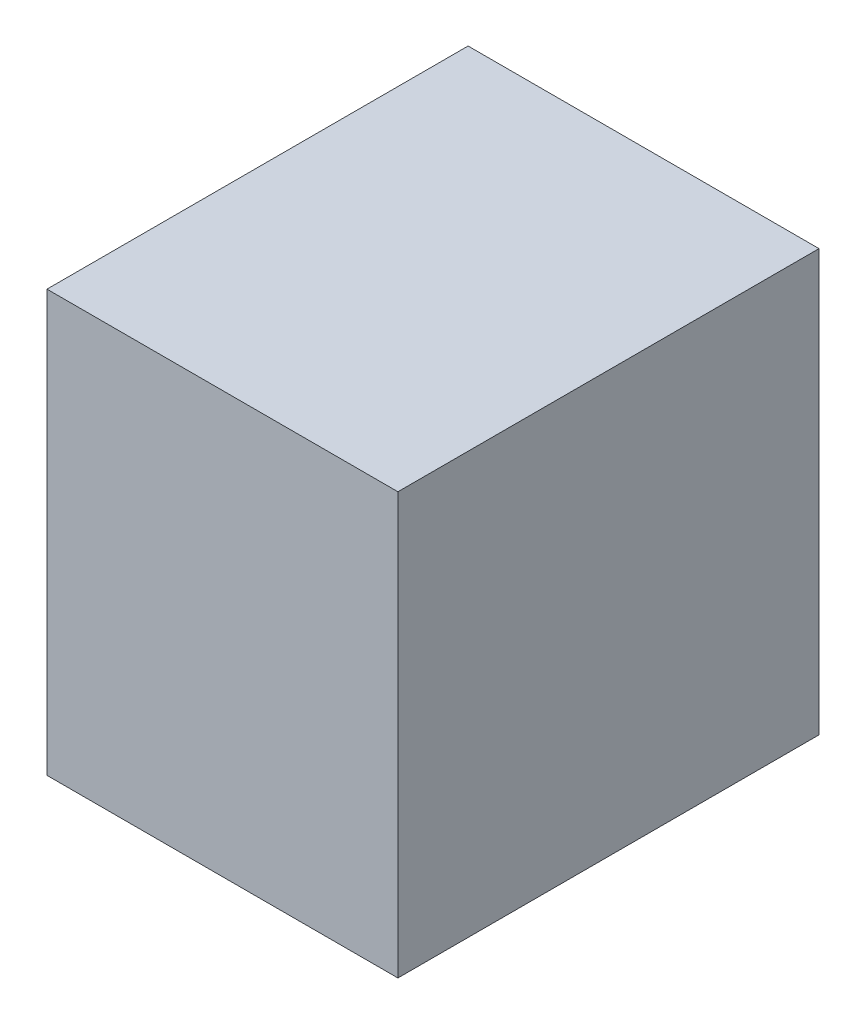
from build123d import *

# Parameters (mm, degrees)
SKETCH_1_W      = 25
SKETCH_1_H      = 30
EXTRUDE_1_DEPTH = 30


with BuildPart() as part:
    # Эскиз1 → Бобышка-Вытянуть1 (new body)
    with BuildSketch(Plane.XY):
        with Locations((56.550320868, 22.631091658)):
            Rectangle(SKETCH_1_W, SKETCH_1_H)
    extrude(amount=EXTRUDE_1_DEPTH)


solid = part.part
